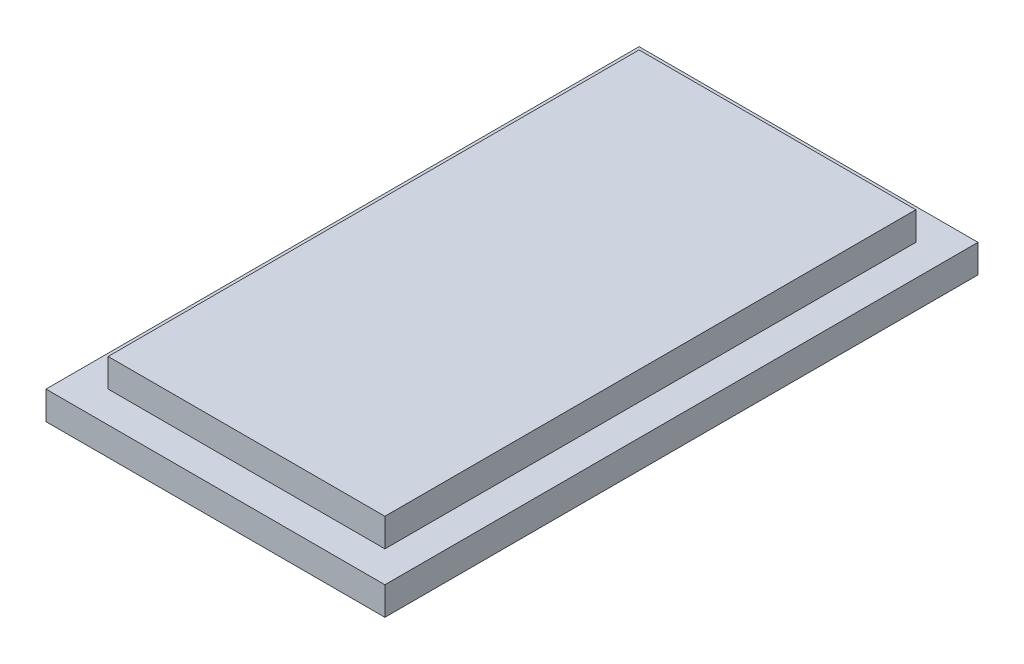
from build123d import *

# Parameters (mm, degrees)
SKETCH1_W           = 36
SKETCH1_H           = 63
BOSS_EXTRUDE1_DEPTH = 3
SKETCH2_W           = 29.4
SKETCH2_H           = 56.4
BOSS_EXTRUDE2_DEPTH = 3


with BuildPart() as part:
    # Sketch1 → Boss-Extrude1 (new body)
    with BuildSketch(Plane(origin=(0, 0, 0), x_dir=(1, 0, 0), z_dir=(0, 1, 0))):
        with Locations((18, 31.5)):
            Rectangle(SKETCH1_W, SKETCH1_H)
    extrude(amount=BOSS_EXTRUDE1_DEPTH)

    # Sketch2 → Boss-Extrude2 (add)
    with BuildSketch(Plane(origin=(0, 3, 0), x_dir=(1, 0, 0), z_dir=(0, 1, 0))):
        with Locations((18, 31.5)):
            Rectangle(SKETCH2_W, SKETCH2_H)
    extrude(amount=BOSS_EXTRUDE2_DEPTH)


solid = part.part
